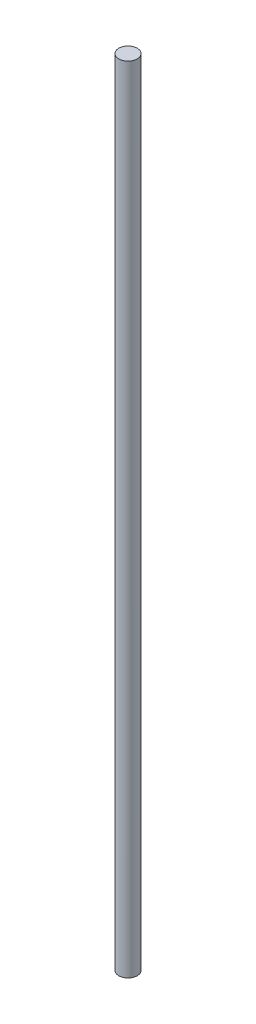
from build123d import *

# Parameters (mm, degrees)
SKETCH1_R           = 12.249340104
BOSS_EXTRUDE1_DEPTH = 1428.75
SKETCH2_R           = 12.249340104
CUT_EXTRUDE1_DEPTH  = 375.92


with BuildPart() as part:
    # Sketch1 → Boss-Extrude1 (new body)
    with BuildSketch(Plane(origin=(0, 52.307577379, 0), x_dir=(1, 0, 0), z_dir=(0, 1, 0))):
        with Locations(Location((0, 760.214935882, 0), (0, 0, 270))):
            Circle(SKETCH1_R)
    extrude(amount=BOSS_EXTRUDE1_DEPTH)

    # Sketch2 → Cut-Extrude1 (cut)
    with BuildSketch(Plane.XZ.offset(-52.307577379)):
        with Locations(Location((0, -760.214935882, 0), (0, 0, 270))):
            Circle(SKETCH2_R)
    extrude(amount=-CUT_EXTRUDE1_DEPTH, mode=Mode.SUBTRACT)


solid = part.part
